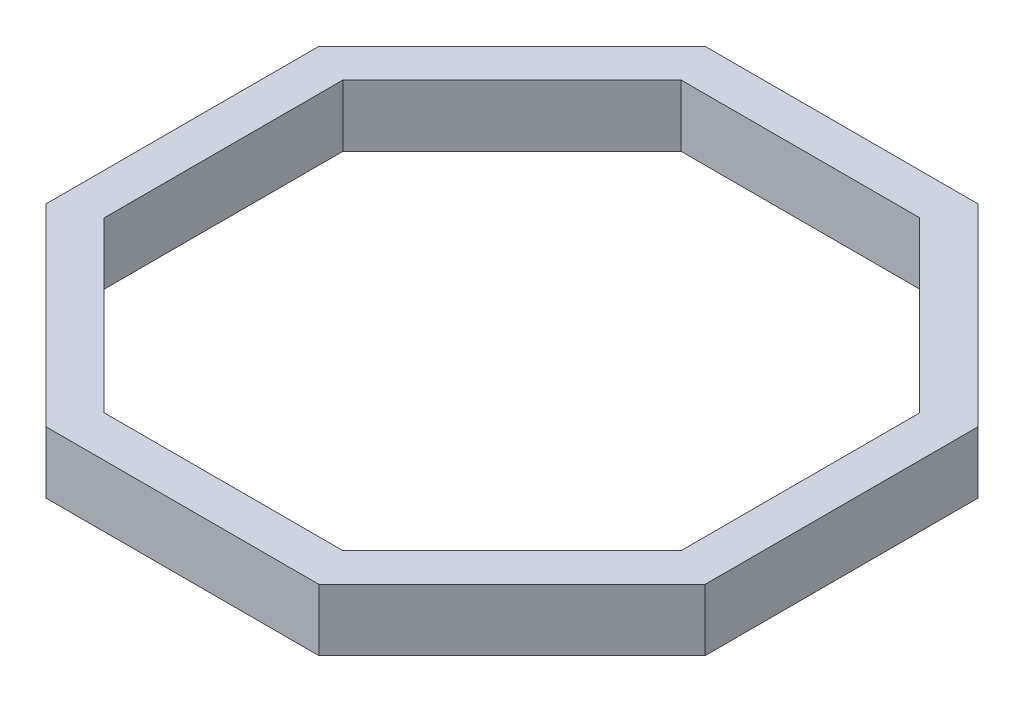
from build123d import *

# Parameters (mm, degrees)
RESSALTO_EXTRUS_O1_DEPTH = 30
CORTE_EXTRUS_O1_DEPTH    = 30


with BuildPart() as part:
    # Esboço1 → Ressalto-extrusão1 (new body)
    with BuildSketch(Plane(origin=(0, 0, 0), x_dir=(1, 0, 0), z_dir=(0, 1, 0))):
        Polygon((160, 66.27416998), (66.27416998, 160), (-66.27416998, 160), (-160, 66.27416998), (-160, -66.27416998), (-66.27416998, -160), (66.27416998, -160), (160, -66.27416998), align=None)
    extrude(amount=RESSALTO_EXTRUS_O1_DEPTH)

    # Esboço2 → Corte-extrusão1 (cut)
    with BuildSketch(Plane(origin=(0, 30, 0), x_dir=(1, 0, 0), z_dir=(0, 1, 0))):
        Polygon((140, 57.989898732), (57.989898732, 140), (-57.989898732, 140), (-140, 57.989898732), (-140, -57.989898732), (-57.989898732, -140), (57.989898732, -140), (140, -57.989898732), align=None)
    extrude(amount=-CORTE_EXTRUS_O1_DEPTH, mode=Mode.SUBTRACT)


solid = part.part
